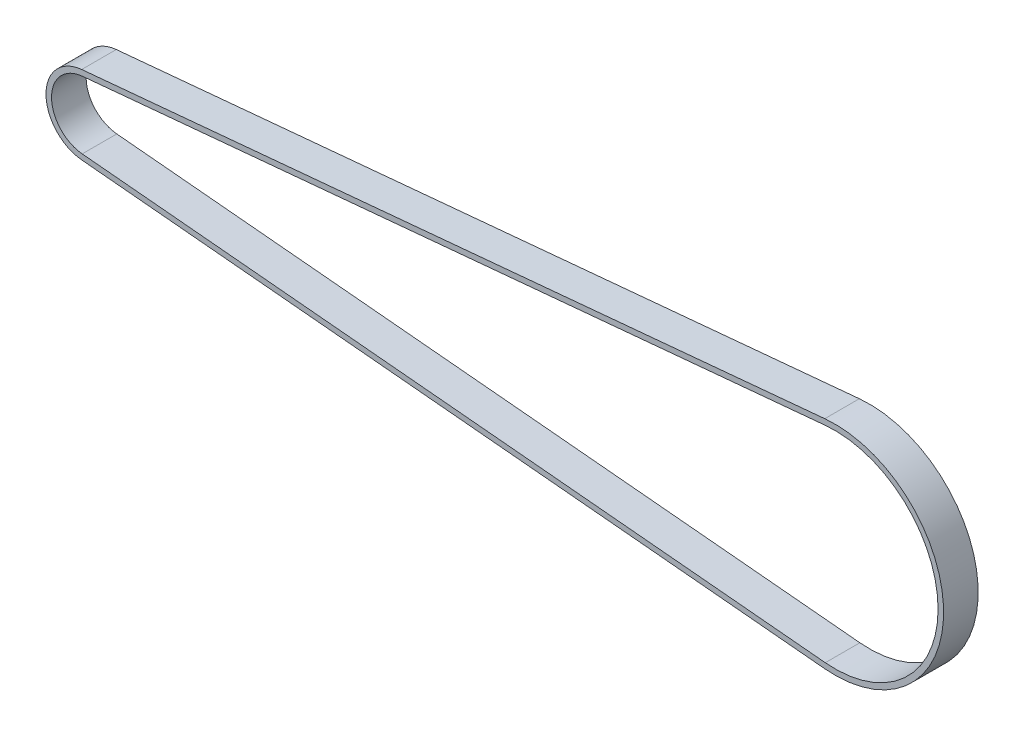
from build123d import *

# Parameters (mm, degrees)
EXTRUDE_THIN1_DEPTH = 6.35


with BuildPart() as part:
    # Sketch1 → Extrude-Thin1 (new body)
    with BuildSketch(Plane.XY):
        with BuildLine():
            Line((135.817722472, -19.89122916), (-0.669299373, -7.195238011))
            ThreePointArc((-0.669299373, -7.195238011), (-7.2263, 0), (-0.669299373, 7.195238011))
            Line((-0.669299373, 7.195238011), (135.817722472, 19.89122916))
            ThreePointArc((135.817722472, 19.89122916), (157.6451, 0), (135.817722472, -19.89122916))
        make_face()
        with BuildLine():
            Line((135.911824317, -18.879596399), (-0.575197528, -6.183605251))
            ThreePointArc((-0.575197528, -6.183605251), (-6.2103, 0), (-0.575197528, 6.183605251))
            Line((-0.575197528, 6.183605251), (135.911824317, 18.879596399))
            ThreePointArc((135.911824317, 18.879596399), (156.6291, 0), (135.911824317, -18.879596399))
        make_face(mode=Mode.SUBTRACT)
    extrude(amount=EXTRUDE_THIN1_DEPTH)


solid = part.part
